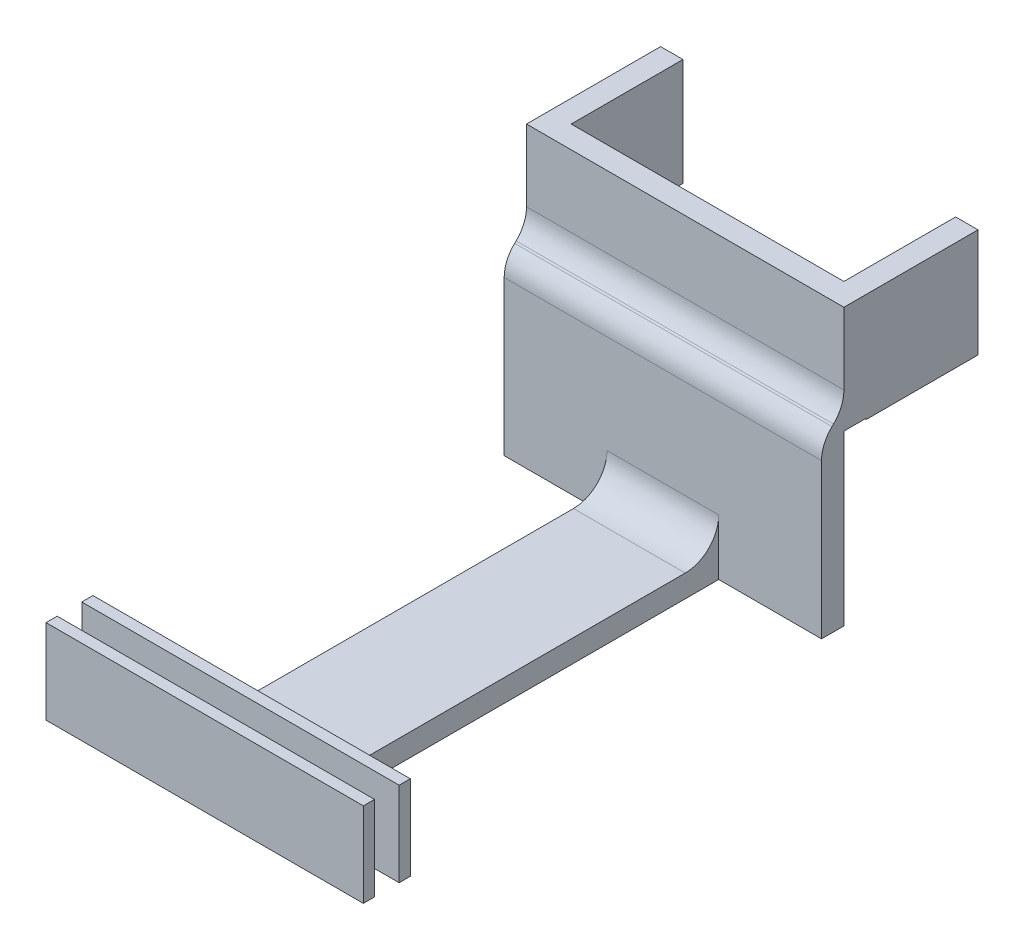
from build123d import *

# Parameters (mm, degrees)
ESQUISSE1_W                = 28.4
ESQUISSE1_H                = 15.1
BOSS_EXTRU_1_DEPTH         = 2
ESQUISSE2_W                = 28.4
ESQUISSE2_H                = 9.6
BOSS_EXTRU_2_DEPTH         = 2
ESQUISSE3_W                = 2
ESQUISSE3_H                = 9.6
ESQUISSE3_H_2              = 9.7
BOSS_EXTRU_3_DEPTH         = 10
ESQUISSE4_W                = 10
ESQUISSE4_H                = 40
BOSS_EXTRU_4_DEPTH         = 2
BOSS_EXTRU_5_DEPTH         = 2.2
ESQUISSE6_W                = 28.4
ESQUISSE6_H                = 7.560696408
BOSS_EXTRU_6_DEPTH         = 1
R_P_TITION_LIN_AIRE1_COUNT = 2
R_P_TITION_LIN_AIRE1_PITCH = 3.2
ESQUISSE7_W                = 2.65
ESQUISSE7_H                = 2.2
ENL_V_MAT_EXTRU_1_DEPTH    = 57.310301011
BOSS_EXTRU_7_DEPTH         = 28.4
CONG_1_R                   = 3


with BuildPart() as part:
    # Esquisse1 → Boss.-Extru.1 (new body)
    with BuildSketch(Plane.XY):
        with Locations((14.2, 7.55)):
            Rectangle(ESQUISSE1_W, ESQUISSE1_H)
    extrude(amount=BOSS_EXTRU_1_DEPTH)

    # Esquisse4 → Boss.-Extru.4 (add)
    with BuildSketch(Plane.XZ):
        with Locations((14.2, 22)):
            Rectangle(ESQUISSE4_W, ESQUISSE4_H)
    extrude(amount=-BOSS_EXTRU_4_DEPTH)

    # Esquisse5 → Boss.-Extru.5 (add)
    with BuildSketch(Plane.XY.offset(42)):
        with BuildLine():
            Line((11.85, 2.5), (11.85, 2))
            Line((11.85, 2), (16.55, 2))
            Line((16.55, 2), (16.55, 2.5))
            ThreePointArc((16.55, 2.5), (14.2, 4.85), (11.85, 2.5))
        make_face()
    extrude(amount=-BOSS_EXTRU_5_DEPTH)

    # Esquisse6 → Boss.-Extru.6 (add)
    with BuildSketch(Plane.XY.offset(42)):
        with Locations((14.2, 3.780348204)):
            Rectangle(ESQUISSE6_W, ESQUISSE6_H)
    boss_extru_6 = extrude(amount=BOSS_EXTRU_6_DEPTH)

    # Répétition linéaire1: Boss.-Extru.6 ×2
    with Locations(*[(0, 0, -i * R_P_TITION_LIN_AIRE1_PITCH) for i in range(1, R_P_TITION_LIN_AIRE1_COUNT)]):
        add(boss_extru_6)

    # Esquisse7 → Enlèv. mat.-Extru.1 (cut, through all)
    with BuildSketch(Plane(origin=(0, 2, 0), x_dir=(1, 0, 0), z_dir=(0, 1, 0))):
        with Locations((17.875, -40.9)):
            Rectangle(ESQUISSE7_W, ESQUISSE7_H)
        with Locations((10.525, -40.9)):
            Rectangle(ESQUISSE7_W, ESQUISSE7_H)
    extrude(amount=-ENL_V_MAT_EXTRU_1_DEPTH, mode=Mode.SUBTRACT)



with BuildPart() as body_2:
    # Esquisse2 → Boss.-Extru.2 (new body)
    with BuildSketch(Plane(origin=(0, 0, 0), x_dir=(-1, 0, 0), z_dir=(0, 0, -1))):
        with Locations((-14.2, 19.9)):
            Rectangle(ESQUISSE2_W, ESQUISSE2_H)
    extrude(amount=BOSS_EXTRU_2_DEPTH)

    # Esquisse3 → Boss.-Extru.3 (add)
    with BuildSketch(Plane(origin=(0, 0, -2), x_dir=(-1, 0, 0), z_dir=(0, 0, -1))):
        with Locations((-1, 19.9)):
            Rectangle(ESQUISSE3_W, ESQUISSE3_H)
        with Locations((-27.4, 19.85)):
            Rectangle(ESQUISSE3_W, ESQUISSE3_H_2)
    extrude(amount=BOSS_EXTRU_3_DEPTH)


with BuildPart() as part_1:
    add(part.part)

    add(body_2.part)  # Boss.-Extru.7 merges body 2
    # Esquisse9 → Boss.-Extru.7 (add)
    with BuildSketch(Plane.ZY):
        Polygon((0, 15.1), (2, 15.1), (0, 17), align=None)
    extrude(amount=-BOSS_EXTRU_7_DEPTH)

    # Congé1
    cong_1_edges = [part_1.edges().sort_by_distance(p)[0] for p in [
        (14.2, 17, 0),
        (14.2, 15.1, 2),
        (14.2, 2, 2),
        (14.2, 2, 38.8),
    ]]
    fillet(cong_1_edges, radius=CONG_1_R)


solid = part_1.part
